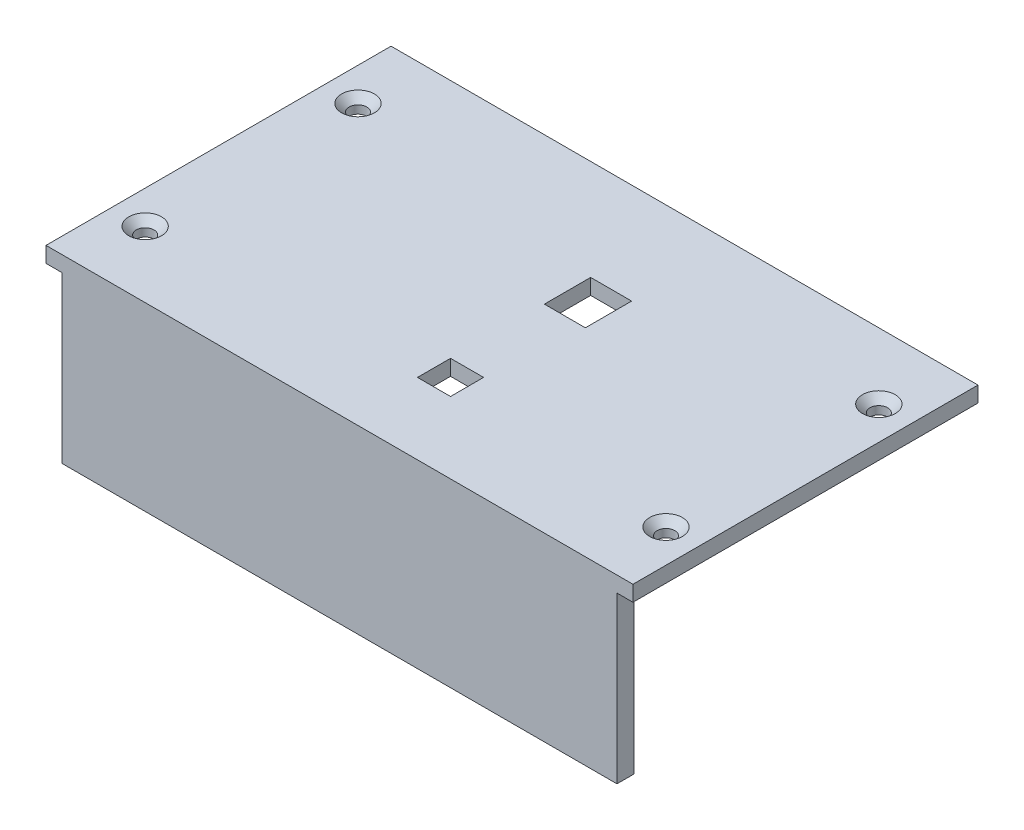
from build123d import *

# Parameters (mm, degrees)
SKETCH1_W                                    = 112.776
SKETCH1_H                                    = 66.294
BOSS_EXTRUDE1_DEPTH                          = 3
CSK_FOR_M3_COUNTERSUNK_FLAT_HEAD_SCR_2_COUNT = 2
CSK_FOR_M3_COUNTERSUNK_FLAT_HEAD_SCR_2_PITCH = 40.894
CSK_FOR_M3_COUNTERSUNK_FLAT_HEAD_SCR_3_COUNT = 2
CSK_FOR_M3_COUNTERSUNK_FLAT_HEAD_SCR_3_PITCH = 108.108857232
CSK_FOR_M3_COUNTERSUNK_FLAT_HEAD_SCR_4_COUNT = 2
CSK_FOR_M3_COUNTERSUNK_FLAT_HEAD_SCR_4_PITCH = 100.076
SKETCH4_W                                    = 106.6292
SKETCH4_H                                    = 3.302
BOSS_EXTRUDE2_DEPTH                          = 31.75
CUT_EXTRUDE1_REACH                           = 76.067
SKETCH6_W                                    = 6.35
SKETCH6_H                                    = 6.35
SKETCH6_W_2                                  = 7.874
SKETCH6_H_2                                  = 8.89


with BuildPart() as part:
    # Sketch1 → Boss-Extrude1 (new body)
    with BuildSketch(Plane(origin=(0, 0, 0), x_dir=(1, 0, 0), z_dir=(0, 1, 0))):
        Rectangle(SKETCH1_W, SKETCH1_H)
    extrude(amount=BOSS_EXTRUDE1_DEPTH)

    # Sketch3 → CSK for M3 Countersunk Flat Head Screw1 (revolve, cut)
    with BuildSketch(Plane(origin=(-50.038, 3, -20.447), x_dir=(0, 0, 1), z_dir=(1, 0, 0))):
        Polygon((0, 0), (0, 3), (1.7, 3), (1.7, 1.45), (3.15, 0), align=None)
    csk_for_m3_countersunk_flat_head_screw1 = revolve(axis=Axis((-50.038, 9.35, -20.447), (0, -1, 0)), mode=Mode.SUBTRACT)

    # CSK for M3 Countersunk Flat Head Scr 2: CSK for M3 Countersunk Flat Head Screw1 ×2
    with Locations(*[(0, 0, i * CSK_FOR_M3_COUNTERSUNK_FLAT_HEAD_SCR_2_PITCH) for i in range(1, CSK_FOR_M3_COUNTERSUNK_FLAT_HEAD_SCR_2_COUNT)]):
        add(csk_for_m3_countersunk_flat_head_screw1, mode=Mode.SUBTRACT)

    # CSK for M3 Countersunk Flat Head Scr 3: CSK for M3 Countersunk Flat Head Screw1 ×2
    with Locations(*[Vector(0.9256965854821381, 0, 0.3782668788391479) * (i * CSK_FOR_M3_COUNTERSUNK_FLAT_HEAD_SCR_3_PITCH) for i in range(1, CSK_FOR_M3_COUNTERSUNK_FLAT_HEAD_SCR_3_COUNT)]):
        add(csk_for_m3_countersunk_flat_head_screw1, mode=Mode.SUBTRACT)

    # CSK for M3 Countersunk Flat Head Scr 4: CSK for M3 Countersunk Flat Head Screw1 ×2
    with Locations(*[(i * CSK_FOR_M3_COUNTERSUNK_FLAT_HEAD_SCR_4_PITCH, 0, 0) for i in range(1, CSK_FOR_M3_COUNTERSUNK_FLAT_HEAD_SCR_4_COUNT)]):
        add(csk_for_m3_countersunk_flat_head_screw1, mode=Mode.SUBTRACT)

    # Sketch4 → Boss-Extrude2 (add)
    with BuildSketch(Plane.XZ):
        with Locations((0, 31.496)):
            Rectangle(SKETCH4_W, SKETCH4_H)
    extrude(amount=BOSS_EXTRUDE2_DEPTH)

    # Sketch6 → Cut-Extrude1 (cut, up to next)
    with BuildSketch(Plane(origin=(0, 3, 0), x_dir=(1, 0, 0), z_dir=(0, 1, 0)), mode=Mode.PRIVATE) as cut_extrude1_sk1:
        with Locations((4.445, -16.256)):
            Rectangle(SKETCH6_W, SKETCH6_H)
    cut_extrude1_tool1 = extrude(cut_extrude1_sk1.sketch, amount=-CUT_EXTRUDE1_REACH, mode=Mode.PRIVATE) & part.part
    # Sketch6 → Cut-Extrude1 (cut, up to next)
    with BuildSketch(Plane(origin=(0, 3, 0), x_dir=(1, 0, 0), z_dir=(0, 1, 0)), mode=Mode.PRIVATE) as cut_extrude1_sk2:
        with Locations((5.207, 9.398)):
            Rectangle(SKETCH6_W_2, SKETCH6_H_2)
    cut_extrude1_tool2 = extrude(cut_extrude1_sk2.sketch, amount=-CUT_EXTRUDE1_REACH, mode=Mode.PRIVATE) & part.part
    add(cut_extrude1_tool1.solids().sort_by_distance((4.445, 3, 16.256))[0], mode=Mode.SUBTRACT)
    add(cut_extrude1_tool2.solids().sort_by_distance((5.207, 3, -9.398))[0], mode=Mode.SUBTRACT)


solid = part.part
